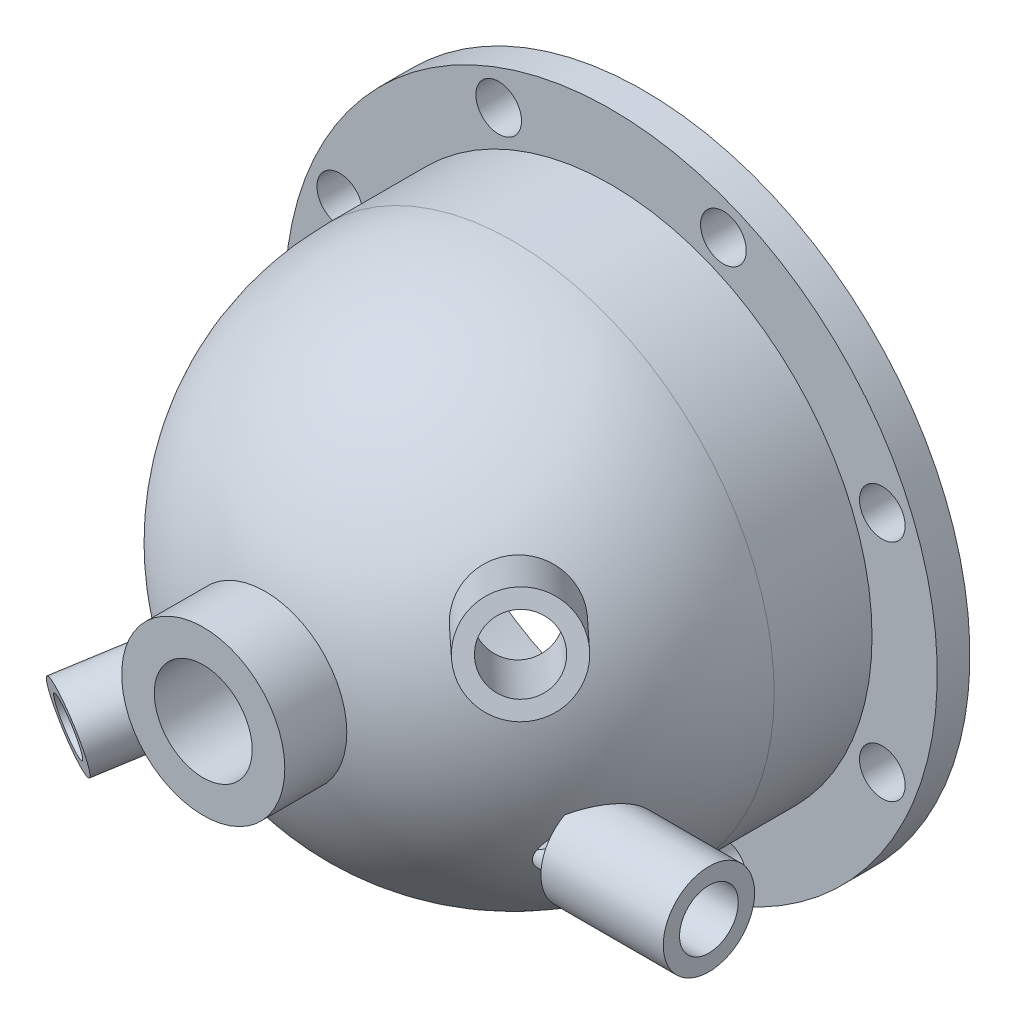
from build123d import *

# Parameters (mm, degrees)
SWEEP_2_PROFILE_R   = 15
SWEEP_4_PROFILE_R   = 12
SWEEP_6_PROFILE_R   = 14
SWEEP_8_PROFILE_R   = 25
SWEEP_2_2_PROFILE_R = 10
SWEEP_4_2_PROFILE_R = 8
SWEEP_6_2_PROFILE_R = 9
SWEEP_8_2_PROFILE_R = 15
SKETCH_20_R         = 7
CUT_EXTRUDE_2_DEPTH = 11


with BuildPart() as part:
    # 草图1 → 旋转1 (revolve)
    with BuildSketch(Plane(origin=(0, 0, 0), x_dir=(1, 0, 0), z_dir=(0, 1, 0)), mode=Mode.PRIVATE) as revolve_1_sk:
        with BuildLine():
            Line((72, 40), (100, 40))
            Line((100, 40), (100, 30))
            Line((100, 30), (80, 30))
            Line((80, 30), (80, 0))
            ThreePointArc((80, 0), (56.5685, -56.5685), (0, -80))
            Line((0, -80), (0, -72))
            ThreePointArc((0, -72), (50.9117, -50.9117), (72, 0))
            Line((72, 0), (72, 30))
            Line((72, 30), (72, 40))
        make_face()
    revolve(revolve_1_sk.sketch.rotate(Axis((0, 0, -40), (0, 0, 1)), 180), axis=Axis((0, 0, -40), (0, 0, 1)))

    # Sweep 2: sweep along a curve in space
    with BuildLine() as sweep_2_path:
        Line((49.092632, 28.343644, 47.566283), (72.975534, 42.132444, 70.706637))
    # Sweep 2 profile (on start of the path) → Sweep 2 (sweep)
    with BuildSketch(Plane(origin=(49.092632, 28.343644, 47.566283), x_dir=(-0.6958540483446167, 0, 0.7181832241165258), z_dir=(0.6634139453077733, 0.38302222272066533, 0.642787611947598))):
        Circle(SWEEP_2_PROFILE_R)
    sweep(path=sweep_2_path.line)

    # Sweep 4: sweep along a curve in space
    with BuildLine() as sweep_4_path:
        Line((-32.04294, -18.5, 64.08588), (-45.466334, -26.25, 90.932667))
    # Sweep 4 profile (on start of the path) → Sweep 4 (sweep)
    with BuildSketch(Plane(origin=(-32.04294, -18.5, 64.08588), x_dir=(0.8944271843367185, 0, 0.4472136088263523), z_dir=(-0.43301271447556855, -0.2500000027702128, 0.8660253966930723))):
        Circle(SWEEP_4_PROFILE_R)
    sweep(path=sweep_4_path.line)

    # Sweep 6: sweep along a curve in space
    with BuildLine() as sweep_6_path:
        Line((62.5, -30, 40), (100, -30, 40))
    # Sweep 6 profile (on start of the path) → Sweep 6 (sweep)
    with BuildSketch(Plane(origin=(62.5, -30, 40), x_dir=(0, 0, 1), z_dir=(1, 0, 0))):
        Circle(SWEEP_6_PROFILE_R)
    sweep(path=sweep_6_path.line)

    # Sweep 8: sweep along a curve in space
    with BuildLine() as sweep_8_path:
        Line((0, 0, 74), (0, 0, 95))
    # Sweep 8 profile (on start of the path) → Sweep 8 (sweep)
    with BuildSketch(Plane.XY.offset(74)):
        Circle(SWEEP_8_PROFILE_R)
    sweep(path=sweep_8_path.line)

    # Sweep 2 2: sweep along a curve in space
    with BuildLine() as sweep_2_2_path:
        Line((-3.31707, -1.915111, -3.213938), (72.975534, 42.132444, 70.706637))
    # Sweep 2 2 profile (on start of the path) → Sweep 2 2 (sweep, cut)
    with BuildSketch(Plane(origin=(-3.31707, -1.915111, -3.213938), x_dir=(-0.6958540451664025, 0, 0.7181832271959254), z_dir=(0.6634139494586755, 0.38302221833387984, 0.6427876102774817))):
        Circle(SWEEP_2_2_PROFILE_R)
    sweep(path=sweep_2_2_path.line, mode=Mode.SUBTRACT)

    # Sweep 4 2: sweep along a curve in space
    with BuildLine() as sweep_4_2_path:
        Line((2.165064, 1.25, -4.330127), (-45.466334, -26.25, 90.932667))
    # Sweep 4 2 profile (on start of the path) → Sweep 4 2 (sweep, cut)
    with BuildSketch(Plane(origin=(2.165064, 1.25, -4.330127), x_dir=(0.8944271872442957, 0, 0.4472136030111984), z_dir=(-0.43301270916031925, -0.250000000040074, 0.8660254001388203))):
        Circle(SWEEP_4_2_PROFILE_R)
    sweep(path=sweep_4_2_path.line, mode=Mode.SUBTRACT)

    # Sweep 6 2: sweep along a curve in space
    with BuildLine() as sweep_6_2_path:
        Line((-20, -30, 40), (100, -30, 40))
    # Sweep 6 2 profile (on start of the path) → Sweep 6 2 (sweep, cut)
    with BuildSketch(Plane(origin=(-20, -30, 40), x_dir=(0, 0, 1), z_dir=(1, 0, 0))):
        Circle(SWEEP_6_2_PROFILE_R)
    sweep(path=sweep_6_2_path.line, mode=Mode.SUBTRACT)

    # Sweep 8 2: sweep along a curve in space
    with BuildLine() as sweep_8_2_path:
        Line((0, 0, -10), (0, 0, 95))
    # Sweep 8 2 profile (on start of the path) → Sweep 8 2 (sweep, cut)
    with BuildSketch(Plane.XY.offset(-10)):
        Circle(SWEEP_8_2_PROFILE_R)
    sweep(path=sweep_8_2_path.line, mode=Mode.SUBTRACT)

    # 草图20 → 切除-拉伸2 (cut)
    with BuildSketch(Plane.XY.offset(-40)):
        with Locations(Location((83.149158, 34.441509, 0), (0, 0, 180))):
            Circle(SKETCH_20_R)
        with Locations(Location((34.441509, 83.149158, 0), (0, 0, 180))):
            Circle(SKETCH_20_R)
        with Locations(Location((-34.441509, 83.149158, 0), (0, 0, 180))):
            Circle(SKETCH_20_R)
        with Locations(Location((-83.149158, 34.441509, 0), (0, 0, 180))):
            Circle(SKETCH_20_R)
        with Locations(Location((-83.149158, -34.441509, 0), (0, 0, 180))):
            Circle(SKETCH_20_R)
        with Locations(Location((-34.441509, -83.149158, 0), (0, 0, 180))):
            Circle(SKETCH_20_R)
        with Locations(Location((34.441509, -83.149158, 0), (0, 0, 180))):
            Circle(SKETCH_20_R)
        with Locations(Location((83.149158, -34.441509, 0), (0, 0, 180))):
            Circle(SKETCH_20_R)
    extrude(amount=CUT_EXTRUDE_2_DEPTH, mode=Mode.SUBTRACT)


solid = part.part
